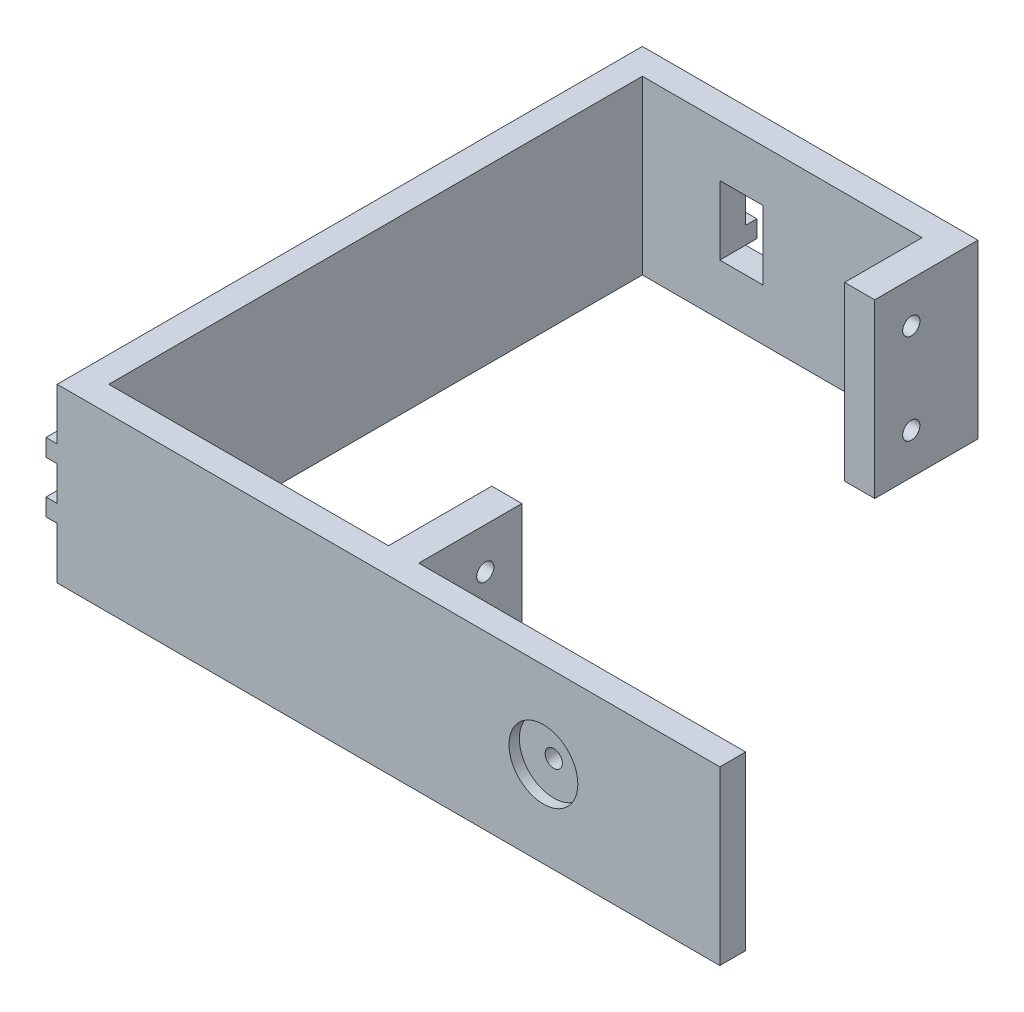
from build123d import *

# Parameters (mm, degrees)
SALIENTE_EXTRUIR1_DEPTH = 20
CROQUIS2_R              = 4
CORTAR_EXTRUIR1_DEPTH   = 1.2
CROQUIS3_R              = 1
CORTAR_EXTRUIR3_DEPTH   = 1.8
CROQUIS4_R              = 1
CORTAR_EXTRUIR4_DEPTH   = 3.5
CROQUIS7_R              = 1
CORTAR_EXTRUIR5_DEPTH   = 3.5
CROQUIS8_W              = 5
CROQUIS8_H              = 8
CORTAR_EXTRUIR6_DEPTH   = 3
CROQUIS9_W              = 12
CROQUIS9_H              = 2
SALIENTE_EXTRUIR2_DEPTH = 1.3
CROQUIS10_W             = 69.3
CROQUIS10_H             = 2
SALIENTE_EXTRUIR3_DEPTH = 1.3


with BuildPart() as part:
    # Croquis1 → Saliente-Extruir1 (new body)
    with BuildSketch(Plane(origin=(0, 0, 0), x_dir=(1, 0, 0), z_dir=(0, 1, 0))):
        Polygon((24.729603414, -41.414237295), (-52.270396586, -41.414237295), (-52.270396586, 26.585762705), (-13.270396586, 26.585762705), (-13.270396586, 14.585762705), (-16.770396586, 14.585762705), (-16.770396586, 23.585762705), (-49.270396586, 23.585762705), (-49.270396586, -38.414237295), (-16.770396586, -38.414237295), (-16.770396586, -26.414237295), (-13.270396586, -26.414237295), (-13.270396586, -38.414237295), (24.729603414, -38.414237295), align=None)
    extrude(amount=SALIENTE_EXTRUIR1_DEPTH)

    # Croquis2 → Cortar-Extruir1 (cut)
    with BuildSketch(Plane.XY.offset(41.414237295)):
        with Locations((4.229603414, 10)):
            Circle(CROQUIS2_R)
    extrude(amount=-CORTAR_EXTRUIR1_DEPTH, mode=Mode.SUBTRACT)

    # Croquis3 → Cortar-Extruir3 (cut)
    with BuildSketch(Plane.XY.offset(40.214237295)):
        with Locations((4.229603414, 10)):
            Circle(CROQUIS3_R)
    extrude(amount=-CORTAR_EXTRUIR3_DEPTH, mode=Mode.SUBTRACT)

    # Croquis4 → Cortar-Extruir4 (cut)
    with BuildSketch(Plane(origin=(-13.270396586, 0, 0), x_dir=(0, 0, -1), z_dir=(1, 0, 0))):
        with Locations((-30.664237295, 15.25)):
            Circle(CROQUIS4_R)
        with Locations((-30.664237295, 4.75)):
            Circle(CROQUIS4_R)
    extrude(amount=-CORTAR_EXTRUIR4_DEPTH, mode=Mode.SUBTRACT)

    # Croquis7 → Cortar-Extruir5 (cut)
    with BuildSketch(Plane(origin=(-13.270396586, 0, 0), x_dir=(0, 0, -1), z_dir=(1, 0, 0))):
        with Locations((18.835762705, 15.25)):
            Circle(CROQUIS7_R)
        with Locations((18.835762705, 4.75)):
            Circle(CROQUIS7_R)
    extrude(amount=-CORTAR_EXTRUIR5_DEPTH, mode=Mode.SUBTRACT)

    # Croquis8 → Cortar-Extruir6 (cut)
    with BuildSketch(Plane.XY.offset(-23.585762705)):
        with Locations((-37.770396586, 10)):
            Rectangle(CROQUIS8_W, CROQUIS8_H)
    extrude(amount=-CORTAR_EXTRUIR6_DEPTH, mode=Mode.SUBTRACT)

    # Croquis9 → Saliente-Extruir2 (add)
    with BuildSketch(Plane(origin=(0, 0, -26.585762705), x_dir=(-1, 0, 0), z_dir=(0, 0, -1))):
        with Locations((46.270396586, 7)):
            Rectangle(CROQUIS9_W, CROQUIS9_H)
        with Locations((46.270396586, 13)):
            Rectangle(CROQUIS9_W, CROQUIS9_H)
    extrude(amount=SALIENTE_EXTRUIR2_DEPTH)

    # Croquis10 → Saliente-Extruir3 (add)
    with BuildSketch(Plane.ZY.offset(52.270396586)):
        with Locations((6.764237295, 13)):
            Rectangle(CROQUIS10_W, CROQUIS10_H)
        with Locations((6.764237295, 7)):
            Rectangle(CROQUIS10_W, CROQUIS10_H)
    extrude(amount=SALIENTE_EXTRUIR3_DEPTH)


solid = part.part
